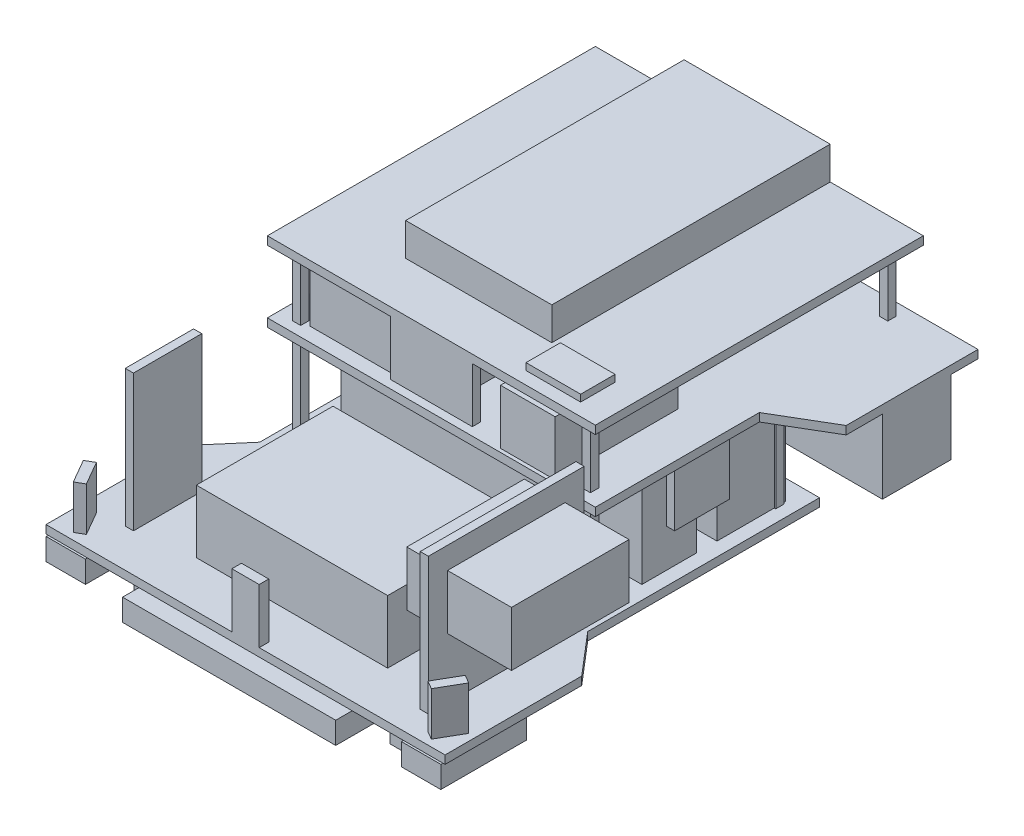
from build123d import *

# Parameters (mm, degrees)
BOSS_EXTRUDE1_DEPTH       = 3
SKETCH2_W                 = 3.05
SKETCH2_H                 = 3.05
BOSS_EXTRUDE2_DEPTH       = 35
SKETCH3_W                 = 120
SKETCH3_H                 = 120
BOSS_EXTRUDE3_DEPTH       = 3
SKETCH4_W                 = 3.05
SKETCH4_H                 = 3.05
BOSS_EXTRUDE4_DEPTH       = 23
SKETCH6_W                 = 120
SKETCH6_H                 = 120
BOSS_EXTRUDE5_DEPTH       = 3
SKETCH7_W                 = 68
SKETCH7_H                 = 25
BOSS_EXTRUDE6_DEPTH       = 27
SKETCH9_W                 = 58
SKETCH9_H                 = 60
SKETCH9_W_2               = 20
SKETCH9_H_2               = 45
SKETCH9_W_3               = 50
SKETCH9_H_3               = 30
BOSS_EXTRUDE7_DEPTH       = 20
SKETCH10_W                = 53.46
SKETCH10_H                = 101.85
BOSS_EXTRUDE8_DEPTH       = 12
SKETCH11_W                = 110
SKETCH11_H                = 20
BOSS_EXTRUDE9_DEPTH       = 32
SKETCH12_W                = 110
SKETCH12_H                = 25
BOSS_EXTRUDE10_DEPTH      = 34
SKETCH13_W                = 20
SKETCH13_H                = 12.6
BOSS_EXTRUDE11_DEPTH      = 2.5
SKETCH14_W                = 3
SKETCH14_H                = 20
BOSS_EXTRUDE12_DEPTH      = 20
BOSS_EXTRUDE13_DEPTH      = 16
SKETCH16_W                = 3
SKETCH16_H                = 57
SKETCH16_H_2              = 25
BOSS_EXTRUDE14_DEPTH      = 50
BOSS_EXTRUDE15_DEPTH      = 23.4
BOSS_EXTRUDE15_DEPTH_BACK = 14.9
SKETCH17_W                = 43
SKETCH17_H                = 20
SKETCH18_W                = 78
SKETCH18_H                = 25
SKETCH18_W_2              = 14.4
SKETCH18_H_2              = 31.3
BOSS_EXTRUDE16_DEPTH      = 8
SKETCH20_W                = 10
SKETCH20_H                = 10
BOSS_EXTRUDE18_DEPTH      = 14.56
SKETCH21_W                = 8
SKETCH21_H                = 8
CUT_EXTRUDE1_DEPTH        = 5
SKETCH22_W                = 10
SKETCH22_H                = 3.5
BOSS_EXTRUDE19_DEPTH      = 20
SKETCH23_W                = 30
SKETCH23_H                = 3
BOSS_EXTRUDE20_DEPTH      = 20
SKETCH24_W                = 70
SKETCH24_H                = 50
BOSS_EXTRUDE21_DEPTH      = 23


with BuildPart() as part:
    # Sketch1 → Boss-Extrude1 (new body)
    with BuildSketch(Plane(origin=(0, 0, 0), x_dir=(1, 0, 0), z_dir=(0, 1, 0))):
        Polygon((-73, -25), (-60, -9.801315846), (-60, 75), (60, 75), (60, -9.801315846), (73, -25), (73, -75), (60, -75), (-60, -75), (-73, -75), align=None)
    extrude(amount=BOSS_EXTRUDE1_DEPTH)

    # Sketch2 → Boss-Extrude2 (add)
    with BuildSketch(Plane(origin=(0, 3, 0), x_dir=(1, 0, 0), z_dir=(0, 1, 0))):
        with Locations((-53, -1.81)):
            Rectangle(SKETCH2_W, SKETCH2_H)
        with Locations((53, -1.81)):
            Rectangle(SKETCH2_W, SKETCH2_H)
        with Locations((54, 65)):
            Rectangle(SKETCH2_W, SKETCH2_H)
        with Locations((-54, 65)):
            Rectangle(SKETCH2_W, SKETCH2_H)
    extrude(amount=BOSS_EXTRUDE2_DEPTH)

    # Sketch3 → Boss-Extrude3 (add)
    with BuildSketch(Plane(origin=(0, 38, 0), x_dir=(1, 0, 0), z_dir=(0, 1, 0))):
        Polygon((-80, 64.780305915), (-60, 52.99), (-60, 112.99), (-80, 112.99), align=None)
        with Locations((0, 52.99)):
            Rectangle(SKETCH3_W, SKETCH3_H)
        Polygon((60, 112.99), (60, 52.99), (80, 64.780305915), (80, 112.99), align=None)
    extrude(amount=BOSS_EXTRUDE3_DEPTH)

    # Sketch4 → Boss-Extrude4 (add)
    with BuildSketch(Plane(origin=(0, 41, 0), x_dir=(1, 0, 0), z_dir=(0, 1, 0))):
        with Locations((-53, -1.81)):
            Rectangle(SKETCH4_W, SKETCH4_H)
        with Locations((-53, 106.99)):
            Rectangle(SKETCH4_W, SKETCH4_H)
        with Locations((53, -1.81)):
            Rectangle(SKETCH4_W, SKETCH4_H)
        with Locations((53, 106.99)):
            Rectangle(SKETCH4_W, SKETCH4_H)
    extrude(amount=BOSS_EXTRUDE4_DEPTH)

    # Sketch6 → Boss-Extrude5 (add)
    with BuildSketch(Plane(origin=(0, 64, 0), x_dir=(1, 0, 0), z_dir=(0, 1, 0))):
        with Locations((0, 52.99)):
            Rectangle(SKETCH6_W, SKETCH6_H)
    extrude(amount=BOSS_EXTRUDE5_DEPTH)

    # Sketch7 → Boss-Extrude6 (add)
    with BuildSketch(Plane.XZ.offset(-38)):
        with Locations((-46, -90.53)):
            Rectangle(SKETCH7_W, SKETCH7_H)
        with Locations((46, -90.53)):
            Rectangle(SKETCH7_W, SKETCH7_H)
    extrude(amount=BOSS_EXTRUDE6_DEPTH)

    # Sketch9 → Boss-Extrude7 (add)
    with BuildSketch(Plane(origin=(0, 41, 0), x_dir=(1, 0, 0), z_dir=(0, 1, 0))):
        with Locations((-1.05, 75.88)):
            Rectangle(SKETCH9_W, SKETCH9_H)
        with Locations((34, 16.79)):
            Rectangle(SKETCH9_W_2, SKETCH9_H_2)
        with Locations((-24.66, 13.16)):
            Rectangle(SKETCH9_W_3, SKETCH9_H_3)
    extrude(amount=BOSS_EXTRUDE7_DEPTH)

    # Sketch10 → Boss-Extrude8 (add)
    with BuildSketch(Plane(origin=(0, 67, 0), x_dir=(1, 0, 0), z_dir=(0, 1, 0))):
        with Locations((-0.81, 62.065)):
            Rectangle(SKETCH10_W, SKETCH10_H)
    extrude(amount=BOSS_EXTRUDE8_DEPTH)

    # Sketch11 → Boss-Extrude9 (add)
    with BuildSketch(Plane(origin=(0, 3, 0), x_dir=(1, 0, 0), z_dir=(0, 1, 0))):
        with Locations((0, 25)):
            Rectangle(SKETCH11_W, SKETCH11_H)
    extrude(amount=BOSS_EXTRUDE9_DEPTH)

    # Sketch12 → Boss-Extrude10 (add)
    with BuildSketch(Plane(origin=(0, 3, 0), x_dir=(1, 0, 0), z_dir=(0, 1, 0))):
        with Locations((0, 55)):
            Rectangle(SKETCH12_W, SKETCH12_H)
    extrude(amount=BOSS_EXTRUDE10_DEPTH)

    # Sketch13 → Boss-Extrude11 (add)
    with BuildSketch(Plane(origin=(0, 67, 0), x_dir=(1, 0, 0), z_dir=(0, 1, 0))):
        with Locations((40, 3.91)):
            Rectangle(SKETCH13_W, SKETCH13_H)
    extrude(amount=BOSS_EXTRUDE11_DEPTH)

    # Sketch14 → Boss-Extrude12 (add)
    with BuildSketch(Plane(origin=(0, 38, 0), x_dir=(1, 0, 0), z_dir=(0, 1, 0))):
        with Locations((57.5, 32.99)):
            Rectangle(SKETCH14_W, SKETCH14_H)
        with Locations((-57.5, 32.99)):
            Rectangle(SKETCH14_W, SKETCH14_H)
    extrude(amount=-BOSS_EXTRUDE12_DEPTH)

    # Sketch15 → Boss-Extrude13 (add)
    with BuildSketch(Plane(origin=(0, 3, 0), x_dir=(1, 0, 0), z_dir=(0, 1, 0))):
        Polygon((65.5, -72.5), (62.468911087, -70.75), (67.468911087, -62.089745962), (70.5, -63.839745962), align=None)
        Polygon((-70.5, -63.839745962), (-65.5, -72.5), (-62.468911087, -70.75), (-67.468911087, -62.089745962), align=None)
    extrude(amount=BOSS_EXTRUDE13_DEPTH)

    # Sketch16 → Boss-Extrude14 (add)
    with BuildSketch(Plane(origin=(0, 3, 0), x_dir=(1, 0, 0), z_dir=(0, 1, 0))):
        with Locations((55.5, -36.6)):
            Rectangle(SKETCH16_W, SKETCH16_H)
        with Locations((-56.5, -48.5)):
            Rectangle(SKETCH16_W, SKETCH16_H_2)
    extrude(amount=BOSS_EXTRUDE14_DEPTH)

    # Sketch17 → Boss-Extrude15 (add, two sides: drawn at the far end of the back side and taken through both)
    with BuildSketch(Plane(origin=(57, 0, 0), x_dir=(0, 0, -1), z_dir=(1, 0, 0)).offset(-BOSS_EXTRUDE15_DEPTH_BACK)):
        with Locations((-36.6, 35)):
            Rectangle(SKETCH17_W, SKETCH17_H)
    extrude(amount=BOSS_EXTRUDE15_DEPTH + BOSS_EXTRUDE15_DEPTH_BACK)

    # Sketch18 → Boss-Extrude16 (add)
    with BuildSketch(Plane.XZ):
        with Locations((0, 68.5)):
            Rectangle(SKETCH18_W, SKETCH18_H)
        with Locations((-65, 60.1)):
            Rectangle(SKETCH18_W_2, SKETCH18_H_2)
        with Locations((65, 60.1)):
            Rectangle(SKETCH18_W_2, SKETCH18_H_2)
    extrude(amount=BOSS_EXTRUDE16_DEPTH)

    # Sketch20 → Boss-Extrude18 (add)
    with BuildSketch(Plane.XZ):
        with Locations((-46.89, 59)):
            Rectangle(SKETCH20_W, SKETCH20_H)
        with Locations((46.89, 59)):
            Rectangle(SKETCH20_W, SKETCH20_H)
    extrude(amount=BOSS_EXTRUDE18_DEPTH)

    # Sketch21 → Cut-Extrude1 (cut)
    with BuildSketch(Plane.XZ.offset(14.56)):
        with Locations((46.89, 59)):
            Rectangle(SKETCH21_W, SKETCH21_H)
        with Locations((-46.89, 59)):
            Rectangle(SKETCH21_W, SKETCH21_H)
    extrude(amount=-CUT_EXTRUDE1_DEPTH, mode=Mode.SUBTRACT)

    # Sketch22 → Boss-Extrude19 (add)
    with BuildSketch(Plane(origin=(0, 3, 0), x_dir=(1, 0, 0), z_dir=(0, 1, 0))):
        with Locations((0, -73.25)):
            Rectangle(SKETCH22_W, SKETCH22_H)
    extrude(amount=BOSS_EXTRUDE19_DEPTH)

    # Sketch23 → Boss-Extrude20 (add)
    with BuildSketch(Plane.XZ.offset(-64)):
        with Locations((0, 5.51)):
            Rectangle(SKETCH23_W, SKETCH23_H)
    extrude(amount=BOSS_EXTRUDE20_DEPTH)

    # Sketch24 → Boss-Extrude21 (add)
    with BuildSketch(Plane(origin=(0, 3, 0), x_dir=(1, 0, 0), z_dir=(0, 1, 0))):
        with Locations((0, -33)):
            Rectangle(SKETCH24_W, SKETCH24_H)
    extrude(amount=BOSS_EXTRUDE21_DEPTH)


solid = part.part
